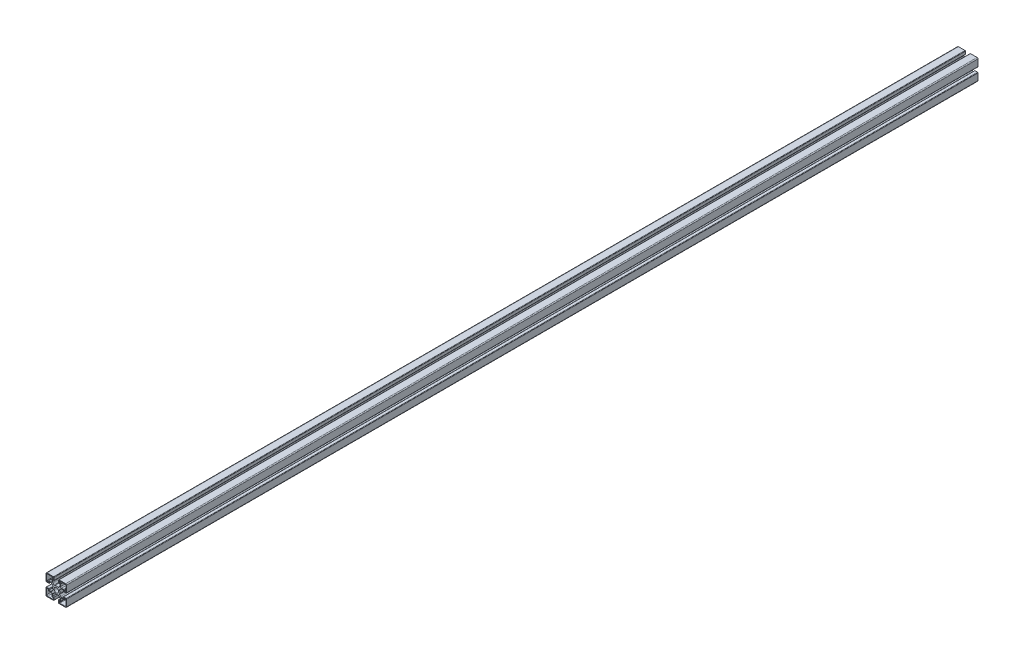
from build123d import *

# Parameters (mm, degrees)
SKETCH1_R           = 5
BOSS_EXTRUDE1_DEPTH = 2000


with BuildPart() as part:
    # Sketch1 → Boss-Extrude1 (new body)
    with BuildSketch(Plane.XY):
        with BuildLine():
            Line((-5, -15.705854984), (-8, -15.705854984))
            Line((-8, -15.705854984), (-8, -11.948495671))
            ThreePointArc((-8, -11.948495671), (-7.771638598, -10.800445374), (-7.121320344, -9.827175327))
            Line((-7.121320344, -9.827175327), (-4.66838954, -7.374244523))
            ThreePointArc((-4.66838954, -7.374244523), (-4.125357909, -7.094903463), (-3.52114023, -7.183423382))
            ThreePointArc((-3.52114023, -7.183423382), (0, -8), (3.52114023, -7.183423382))
            ThreePointArc((3.52114023, -7.183423382), (4.125357909, -7.094903463), (4.66838954, -7.374244523))
            Line((4.66838954, -7.374244523), (7.121320344, -9.827175327))
            ThreePointArc((7.121320344, -9.827175327), (7.771638598, -10.800445374), (8, -11.948495671))
            Line((8, -11.948495671), (8, -15.705854984))
            Line((8, -15.705854984), (5, -15.705854984))
            Line((5, -15.705854984), (5, -21.5))
            ThreePointArc((5, -21.5), (5.292893219, -22.207106781), (6, -22.5))
            Line((6, -22.5), (20.5, -22.5))
            ThreePointArc((20.5, -22.5), (21.914213562, -21.914213562), (22.5, -20.5))
            Line((22.5, -20.5), (22.5, -6))
            ThreePointArc((22.5, -6), (22.207106781, -5.292893219), (21.5, -5))
            Line((21.5, -5), (15.705854984, -5))
            Line((15.705854984, -5), (15.705854984, -8))
            Line((15.705854984, -8), (11.948495671, -8))
            ThreePointArc((11.948495671, -8), (10.800445374, -7.771638598), (9.827175327, -7.121320344))
            Line((9.827175327, -7.121320344), (7.374244523, -4.66838954))
            ThreePointArc((7.374244523, -4.66838954), (7.094903463, -4.125357909), (7.183423382, -3.52114023))
            ThreePointArc((7.183423382, -3.52114023), (8, 0), (7.183423382, 3.52114023))
            ThreePointArc((7.183423382, 3.52114023), (7.094903463, 4.125357909), (7.374244523, 4.66838954))
            Line((7.374244523, 4.66838954), (9.827175327, 7.121320344))
            ThreePointArc((9.827175327, 7.121320344), (10.800445374, 7.771638598), (11.948495671, 8))
            Line((11.948495671, 8), (15.705854984, 8))
            Line((15.705854984, 8), (15.705854984, 5))
            Line((15.705854984, 5), (21.5, 5))
            ThreePointArc((21.5, 5), (22.207106781, 5.292893219), (22.5, 6))
            Line((22.5, 6), (22.5, 20.5))
            ThreePointArc((22.5, 20.5), (21.914213562, 21.914213562), (20.5, 22.5))
            Line((20.5, 22.5), (6, 22.5))
            ThreePointArc((6, 22.5), (5.292893219, 22.207106781), (5, 21.5))
            Line((5, 21.5), (5, 15.705854984))
            Line((5, 15.705854984), (8, 15.705854984))
            Line((8, 15.705854984), (8, 11.948495671))
            ThreePointArc((8, 11.948495671), (7.771638598, 10.800445374), (7.121320344, 9.827175327))
            Line((7.121320344, 9.827175327), (4.66838954, 7.374244523))
            ThreePointArc((4.66838954, 7.374244523), (4.125357909, 7.094903463), (3.52114023, 7.183423382))
            ThreePointArc((3.52114023, 7.183423382), (0, 8), (-3.52114023, 7.183423382))
            ThreePointArc((-3.52114023, 7.183423382), (-4.125357909, 7.094903463), (-4.66838954, 7.374244523))
            Line((-4.66838954, 7.374244523), (-7.121320344, 9.827175327))
            ThreePointArc((-7.121320344, 9.827175327), (-7.771638598, 10.800445374), (-8, 11.948495671))
            Line((-8, 11.948495671), (-8, 15.705854984))
            Line((-8, 15.705854984), (-5, 15.705854984))
            Line((-5, 15.705854984), (-5, 21.5))
            ThreePointArc((-5, 21.5), (-5.292893219, 22.207106781), (-6, 22.5))
            Line((-6, 22.5), (-20.5, 22.5))
            ThreePointArc((-20.5, 22.5), (-21.914213562, 21.914213562), (-22.5, 20.5))
            Line((-22.5, 20.5), (-22.5, 6))
            ThreePointArc((-22.5, 6), (-22.207106781, 5.292893219), (-21.5, 5))
            Line((-21.5, 5), (-15.705854984, 5))
            Line((-15.705854984, 5), (-15.705854984, 8))
            Line((-15.705854984, 8), (-11.948495671, 8))
            ThreePointArc((-11.948495671, 8), (-10.800445374, 7.771638598), (-9.827175327, 7.121320344))
            Line((-9.827175327, 7.121320344), (-7.374244523, 4.66838954))
            ThreePointArc((-7.374244523, 4.66838954), (-7.094903463, 4.125357909), (-7.183423382, 3.52114023))
            ThreePointArc((-7.183423382, 3.52114023), (-8, 0), (-7.183423382, -3.52114023))
            ThreePointArc((-7.183423382, -3.52114023), (-7.094903463, -4.125357909), (-7.374244523, -4.66838954))
            Line((-7.374244523, -4.66838954), (-9.827175327, -7.121320344))
            ThreePointArc((-9.827175327, -7.121320344), (-10.800445374, -7.771638598), (-11.948495671, -8))
            Line((-11.948495671, -8), (-15.705854984, -8))
            Line((-15.705854984, -8), (-15.705854984, -5))
            Line((-15.705854984, -5), (-21.5, -5))
            ThreePointArc((-21.5, -5), (-22.207106781, -5.292893219), (-22.5, -6))
            Line((-22.5, -6), (-22.5, -20.5))
            ThreePointArc((-22.5, -20.5), (-21.914213562, -21.914213562), (-20.5, -22.5))
            Line((-20.5, -22.5), (-6, -22.5))
            ThreePointArc((-6, -22.5), (-5.292893219, -22.207106781), (-5, -21.5))
            Line((-5, -21.5), (-5, -15.705854984))
        make_face()
        Circle(SKETCH1_R, mode=Mode.SUBTRACT)
        with BuildLine():
            Line((-19, -21), (-7.5, -21))
            ThreePointArc((-7.5, -21), (-6.792893219, -20.707106781), (-6.5, -20))
            Line((-6.5, -20), (-6.5, -18.205854984))
            ThreePointArc((-6.5, -18.205854984), (-6.792893219, -17.498748202), (-7.5, -17.205854984))
            Line((-7.5, -17.205854984), (-8.5, -17.205854984))
            ThreePointArc((-8.5, -17.205854984), (-9.207106781, -16.912961765), (-9.5, -16.205854984))
            Line((-9.5, -16.205854984), (-9.5, -11.5))
            ThreePointArc((-9.5, -11.5), (-10.085786438, -10.085786438), (-11.5, -9.5))
            Line((-11.5, -9.5), (-16.205854984, -9.5))
            ThreePointArc((-16.205854984, -9.5), (-16.912961765, -9.207106781), (-17.205854984, -8.5))
            Line((-17.205854984, -8.5), (-17.205854984, -7.5))
            ThreePointArc((-17.205854984, -7.5), (-17.498748202, -6.792893219), (-18.205854984, -6.5))
            Line((-18.205854984, -6.5), (-20, -6.5))
            ThreePointArc((-20, -6.5), (-20.707106781, -6.792893219), (-21, -7.5))
            Line((-21, -7.5), (-21, -19))
            ThreePointArc((-21, -19), (-20.414213562, -20.414213562), (-19, -21))
        make_face(mode=Mode.SUBTRACT)
        with BuildLine():
            Line((-9.5, 16.205854984), (-9.5, 11.5))
            ThreePointArc((-9.5, 11.5), (-10.085786438, 10.085786438), (-11.5, 9.5))
            Line((-11.5, 9.5), (-16.205854984, 9.5))
            ThreePointArc((-16.205854984, 9.5), (-16.912961765, 9.207106781), (-17.205854984, 8.5))
            Line((-17.205854984, 8.5), (-17.205854984, 7.5))
            ThreePointArc((-17.205854984, 7.5), (-17.498748202, 6.792893219), (-18.205854984, 6.5))
            Line((-18.205854984, 6.5), (-20, 6.5))
            ThreePointArc((-20, 6.5), (-20.707106781, 6.792893219), (-21, 7.5))
            Line((-21, 7.5), (-21, 19))
            ThreePointArc((-21, 19), (-20.414213562, 20.414213562), (-19, 21))
            Line((-19, 21), (-7.5, 21))
            ThreePointArc((-7.5, 21), (-6.792893219, 20.707106781), (-6.5, 20))
            Line((-6.5, 20), (-6.5, 18.205854984))
            ThreePointArc((-6.5, 18.205854984), (-6.792893219, 17.498748202), (-7.5, 17.205854984))
            Line((-7.5, 17.205854984), (-8.5, 17.205854984))
            ThreePointArc((-8.5, 17.205854984), (-9.207106781, 16.912961765), (-9.5, 16.205854984))
        make_face(mode=Mode.SUBTRACT)
        with BuildLine():
            Line((16.205854984, 9.5), (11.5, 9.5))
            ThreePointArc((11.5, 9.5), (10.085786438, 10.085786438), (9.5, 11.5))
            Line((9.5, 11.5), (9.5, 16.205854984))
            ThreePointArc((9.5, 16.205854984), (9.207106781, 16.912961765), (8.5, 17.205854984))
            Line((8.5, 17.205854984), (7.5, 17.205854984))
            ThreePointArc((7.5, 17.205854984), (6.792893219, 17.498748202), (6.5, 18.205854984))
            Line((6.5, 18.205854984), (6.5, 20))
            ThreePointArc((6.5, 20), (6.792893219, 20.707106781), (7.5, 21))
            Line((7.5, 21), (19, 21))
            ThreePointArc((19, 21), (20.414213562, 20.414213562), (21, 19))
            Line((21, 19), (21, 7.5))
            ThreePointArc((21, 7.5), (20.707106781, 6.792893219), (20, 6.5))
            Line((20, 6.5), (18.205854984, 6.5))
            ThreePointArc((18.205854984, 6.5), (17.498748202, 6.792893219), (17.205854984, 7.5))
            Line((17.205854984, 7.5), (17.205854984, 8.5))
            ThreePointArc((17.205854984, 8.5), (16.912961765, 9.207106781), (16.205854984, 9.5))
        make_face(mode=Mode.SUBTRACT)
        with BuildLine():
            Line((9.5, -16.205854984), (9.5, -11.5))
            ThreePointArc((9.5, -11.5), (10.085786438, -10.085786438), (11.5, -9.5))
            Line((11.5, -9.5), (16.205854984, -9.5))
            ThreePointArc((16.205854984, -9.5), (16.912961765, -9.207106781), (17.205854984, -8.5))
            Line((17.205854984, -8.5), (17.205854984, -7.5))
            ThreePointArc((17.205854984, -7.5), (17.498748202, -6.792893219), (18.205854984, -6.5))
            Line((18.205854984, -6.5), (20, -6.5))
            ThreePointArc((20, -6.5), (20.707106781, -6.792893219), (21, -7.5))
            Line((21, -7.5), (21, -19))
            ThreePointArc((21, -19), (20.414213562, -20.414213562), (19, -21))
            Line((19, -21), (7.5, -21))
            ThreePointArc((7.5, -21), (6.792893219, -20.707106781), (6.5, -20))
            Line((6.5, -20), (6.5, -18.205854984))
            ThreePointArc((6.5, -18.205854984), (6.792893219, -17.498748202), (7.5, -17.205854984))
            Line((7.5, -17.205854984), (8.5, -17.205854984))
            ThreePointArc((8.5, -17.205854984), (9.207106781, -16.912961765), (9.5, -16.205854984))
        make_face(mode=Mode.SUBTRACT)
    extrude(amount=BOSS_EXTRUDE1_DEPTH)


solid = part.part
